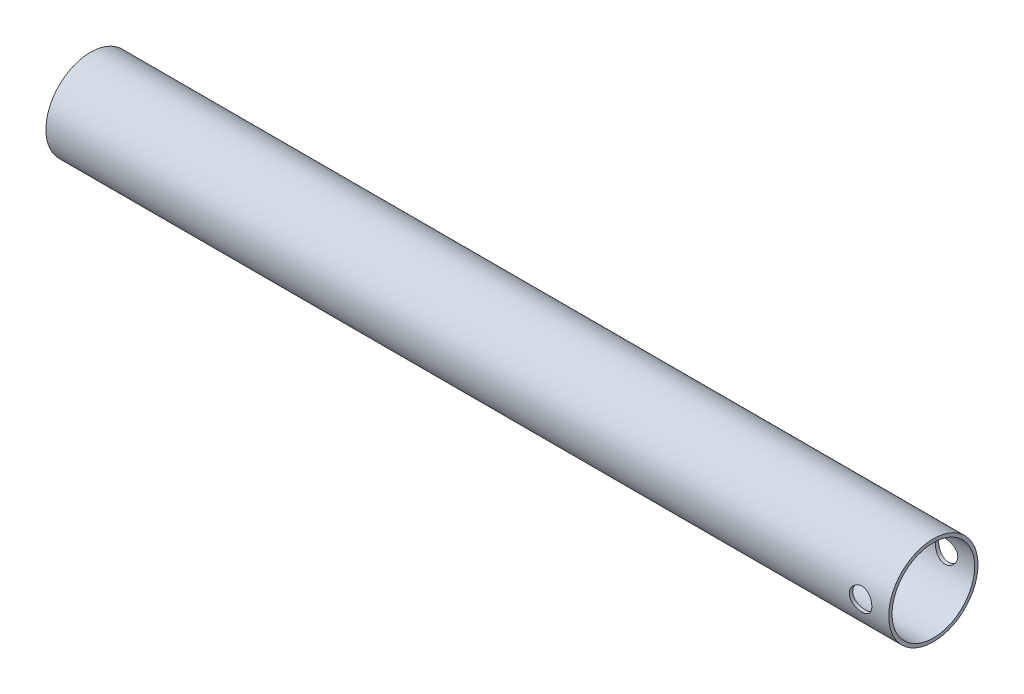
from build123d import *

# Parameters (mm, degrees)
SKETCH1_R           = 15.9
SKETCH1_R_2         = 14.7
BOSS_EXTRUDE1_DEPTH = 300
SKETCH4_R           = 4
CUT_EXTRUDE1_DEPTH  = 303.09940417


with BuildPart() as part:
    # Sketch1 → Boss-Extrude1 (new body)
    with BuildSketch(Plane(origin=(0, 0, 0), x_dir=(0, 0, -1), z_dir=(1, 0, 0))):
        Circle(SKETCH1_R)
        Circle(SKETCH1_R_2, mode=Mode.SUBTRACT)
    extrude(amount=BOSS_EXTRUDE1_DEPTH)

    # Sketch4 → Cut-Extrude1 (cut, through all)
    with BuildSketch(Plane(origin=(0, 0, -15.9), x_dir=(1, 0, 0), z_dir=(0, 0, -1))):
        with Locations(Location((290, 0, 0), (0, 0, 180))):
            Circle(SKETCH4_R)
    extrude(amount=-CUT_EXTRUDE1_DEPTH, mode=Mode.SUBTRACT)


solid = part.part
